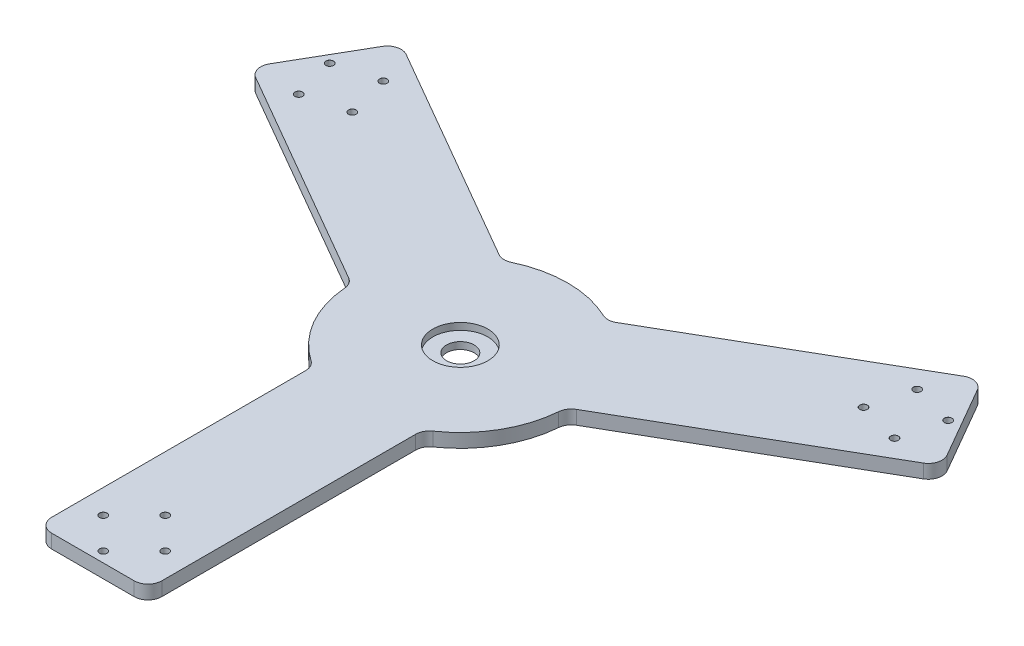
from build123d import *

# Parameters (mm, degrees)
SKETCH1_R                      = 78
BOSS_EXTRUDE1_DEPTH            = 10
BOSS_EXTRUDE2_DEPTH            = 10
FILLET1_R                      = 10
M5_CLEARANCE_HOLE1_D           = 5.5
M5_CLEARANCE_HOLE1_CSINK_D     = 5.55
M5_CLEARANCE_HOLE1_CSINK_ANGLE = 90
CIRPATTERN1_COUNT              = 3
FILLET1_OF_CIRPATTERN1_R       = 10
HOLE1_D                        = 20
HOLE1_CBORE_D                  = 40
HOLE1_CBORE_DEPTH              = 5


with BuildPart() as part:
    # Sketch1 → Boss-Extrude1 (new body)
    with BuildSketch(Plane(origin=(0, 0, 0), x_dir=(1, 0, 0), z_dir=(0, 1, 0))):
        with Locations(Location((0, 0, 0), (0, 0, 270))):
            Circle(SKETCH1_R)
    extrude(amount=BOSS_EXTRUDE1_DEPTH)

    # Sketch4 → Boss-Extrude2 (add)
    with BuildSketch(Plane.XZ):
        with BuildLine():
            Line((-40, 66.962676171), (-40, 266.962676171))
            Line((-40, 266.962676171), (40, 266.962676171))
            Line((40, 266.962676171), (40, 66.962676171))
            ThreePointArc((40, 66.962676171), (0, 78), (-40, 66.962676171))
        make_face()
    boss_extrude2 = extrude(amount=-BOSS_EXTRUDE2_DEPTH)

    # Fillet1
    fillet1_edges = [part.edges().sort_by_distance(p)[0] for p in [
        (40, 5, 266.962676171),
        (-40, 5, 266.962676171),
        (-40, 5, 66.962676171),
        (40, 5, 66.962676171),
    ]]
    fillet(fillet1_edges, radius=FILLET1_R)

    # M5 Clearance Hole1 (through all)
    with Locations(Plane(origin=(0, 10, 0), x_dir=(1, 0, 0), z_dir=(0, 1, 0))):
        with Locations((0, -259.462676171), (-22.5, -236.962676171), (22.5, -236.962676171), (0, -214.462676171)):
            m5_clearance_hole1 = CounterSinkHole(M5_CLEARANCE_HOLE1_D / 2, M5_CLEARANCE_HOLE1_CSINK_D / 2, counter_sink_angle=M5_CLEARANCE_HOLE1_CSINK_ANGLE)

    # CirPattern1: Boss-Extrude2, M5 Clearance Hole1 ×3 about axis
    cirpattern1_axis = Axis((0, 0, 0), (0, 1, 0))
    add([boss_extrude2.rotate(cirpattern1_axis, i * 360 / CIRPATTERN1_COUNT) for i in range(1, CIRPATTERN1_COUNT)])
    add([m5_clearance_hole1.rotate(cirpattern1_axis, i * 360 / CIRPATTERN1_COUNT) for i in range(1, CIRPATTERN1_COUNT)], mode=Mode.SUBTRACT)

    # Fillet1 of CirPattern1
    fillet1_of_cirpattern1_edges = [part.edges().sort_by_distance(p)[0] for p in [
        (211.196459426, 5, -168.122354237),
        (251.196459426, 5, -98.840321934),
        (77.99137867, 5, 1.159678066),
        (37.99137867, 5, -68.122354237),
        (-251.196459426, 5, -98.840321934),
        (-211.196459426, 5, -168.122354237),
        (-37.99137867, 5, -68.122354237),
        (-77.99137867, 5, 1.159678066),
    ]]
    fillet(fillet1_of_cirpattern1_edges, radius=FILLET1_OF_CIRPATTERN1_R)

    # Hole1 (through all)
    with Locations(Plane(origin=(0, 10, 0), x_dir=(1, 0, 0), z_dir=(0, 1, 0))):
        with Locations((0, 0)):
            CounterBoreHole(HOLE1_D / 2, HOLE1_CBORE_D / 2, HOLE1_CBORE_DEPTH)


solid = part.part
